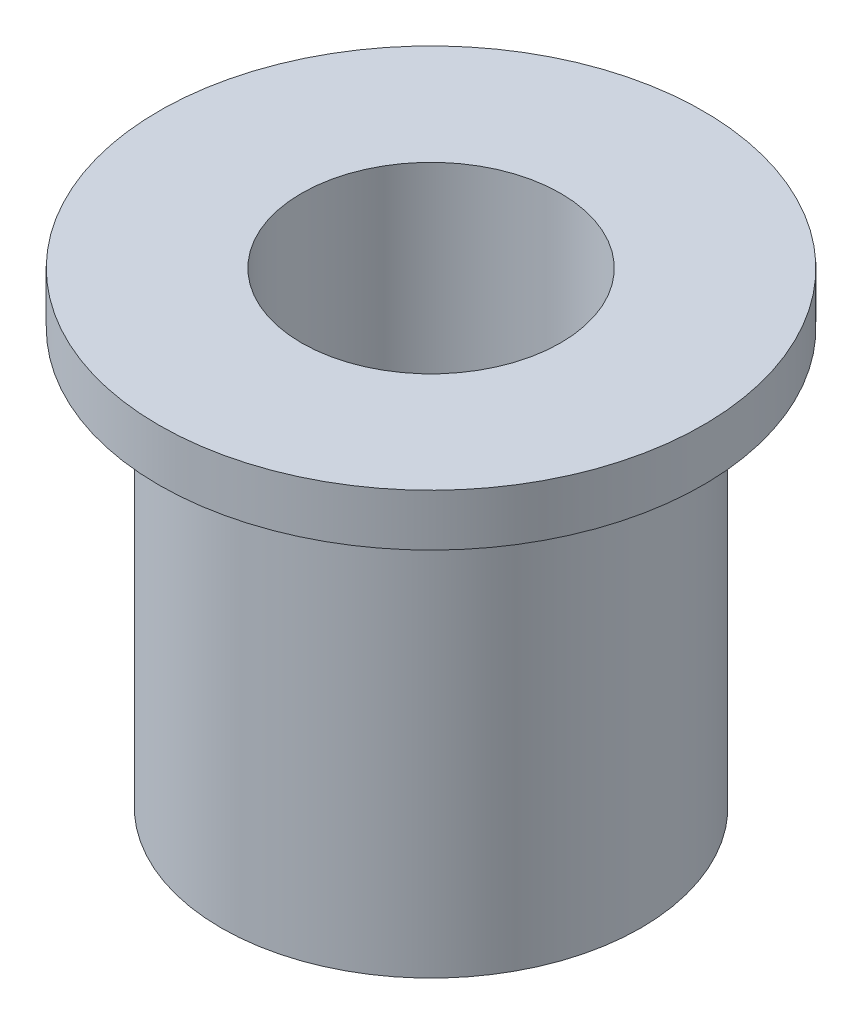
from build123d import *

# Parameters (mm, degrees)
SKETCH1_R           = 4.05
SKETCH1_R_2         = 2.5
BOSS_EXTRUDE1_DEPTH = 9
BOSS_EXTRUDE2_START = -1
SKETCH2_R           = 5.25
SKETCH2_R_2         = 2.5
BOSS_EXTRUDE2_DEPTH = 1
SKETCH3_R           = 3.5
SKETCH3_R_2         = 3.1
CUT_EXTRUDE1_DEPTH  = 4.5


with BuildPart() as part:
    # Sketch1 → Boss-Extrude1 (new body)
    with BuildSketch(Plane(origin=(0, 0, 0), x_dir=(1, 0, 0), z_dir=(0, 1, 0))):
        with Locations(Location((0, 0, 0), (0, 0, 270))):
            Circle(SKETCH1_R)
        with Locations(Location((0, 0, 0), (0, 0, 270))):
            Circle(SKETCH1_R_2, mode=Mode.SUBTRACT)
    extrude(amount=BOSS_EXTRUDE1_DEPTH)

    # Sketch2 → Boss-Extrude2 (add)
    with BuildSketch(Plane(origin=(0, 9, 0), x_dir=(1, 0, 0), z_dir=(0, 1, 0)).offset(BOSS_EXTRUDE2_START)):
        with Locations(Location((0, 0, 0), (0, 0, 270))):
            Circle(SKETCH2_R)
        with Locations(Location((0, 0, 0), (0, 0, 270))):
            Circle(SKETCH2_R_2, mode=Mode.SUBTRACT)
    extrude(amount=BOSS_EXTRUDE2_DEPTH)

    # Sketch3 → Cut-Extrude1 (cut)
    with BuildSketch(Plane.XZ):
        with Locations(Location((0, 0, 0), (0, 0, 270))):
            Circle(SKETCH3_R)
        with Locations(Location((0, 0, 0), (0, 0, 270))):
            Circle(SKETCH3_R_2, mode=Mode.SUBTRACT)
    extrude(amount=-CUT_EXTRUDE1_DEPTH, mode=Mode.SUBTRACT)


solid = part.part
